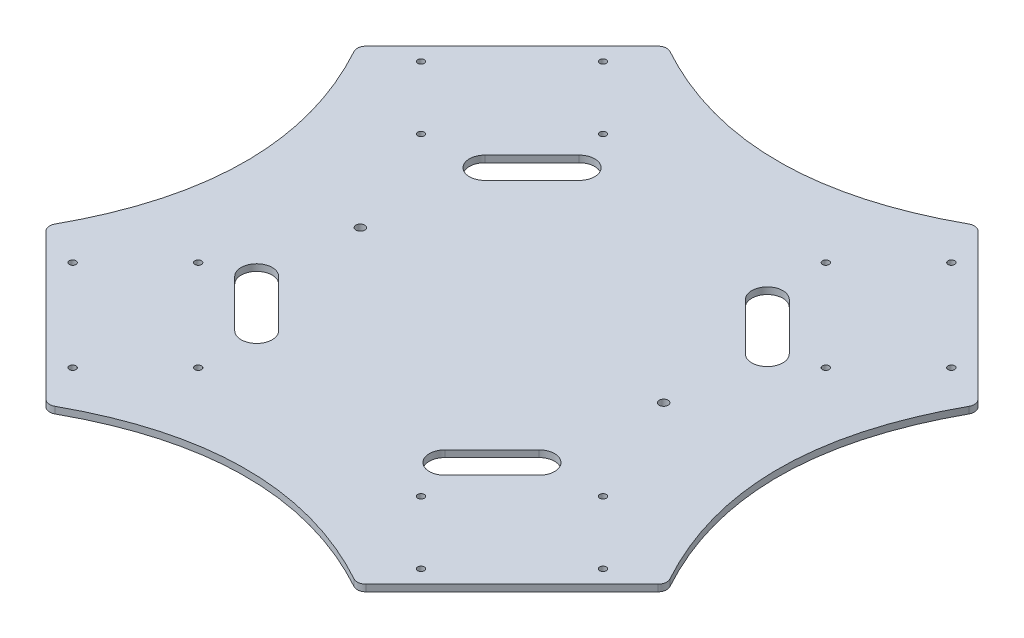
from build123d import *

# Parameters (mm, degrees)
DODANIE_WYCI_GNI_CIE1_DEPTH = 3
ZAOKR_GLENIE1_R             = 4
SZKIC2_R                    = 1.5
WYTNIJ_WYCI_GNI_CIE1_DEPTH  = 197.640104054
SZYK_KO_OWY1_COUNT          = 4
WYTNIJ_WYCI_GNI_CIE2_REACH  = 198.64
SZYK_KO_OWY2_COUNT          = 4
WYTNIJ_WYCI_GNI_CIE3_REACH  = 198.64
SZKIC4_R                    = 2


with BuildPart() as part:
    # Szkic1 → Dodanie-wyciągnięcie1 (new body)
    with BuildSketch(Plane(origin=(0, 0, 0), x_dir=(1, 0, 0), z_dir=(0, 1, 0))):
        with BuildLine():
            Line((-70, -140), (-140, -70))
            add(Edge.make_bspline(
                [(-140, 70), (-100, 0), (-140, -70)],
                knots=[0, 0, 0, 1, 1, 1], degree=2))
            Line((-140, 70), (-70, 140))
            add(Edge.make_bspline(
                [(70, 140), (0, 100), (-70, 140)],
                knots=[0, 0, 0, 1, 1, 1], degree=2))
            Line((70, 140), (140, 70))
            add(Edge.make_bspline(
                [(140, -70), (100, 0), (140, 70)],
                knots=[0, 0, 0, 1, 1, 1], degree=2))
            Line((140, -70), (70, -140))
            add(Edge.make_bspline(
                [(-70, -140), (0, -100), (70, -140)],
                knots=[0, 0, 0, 1, 1, 1], degree=2))
        make_face()
    extrude(amount=DODANIE_WYCI_GNI_CIE1_DEPTH)

    # Zaokrąglenie1
    zaokr_glenie1_edges = [part.edges().sort_by_distance(p)[0] for p in [
        (-140, 1.5, -70),
        (-70, 1.5, -140),
        (70, 1.5, -140),
        (140, 1.5, -70),
        (140, 1.5, 70),
        (70, 1.5, 140),
        (-140, 1.5, 70),
        (-70, 1.5, 140),
    ]]
    fillet(zaokr_glenie1_edges, radius=ZAOKR_GLENIE1_R)

    # Szkic2 → Wytnij-wyciągnięcie1 (cut, through all)
    with BuildSketch(Plane(origin=(0, 3, 0), x_dir=(1, 0, 0), z_dir=(0, 1, 0))):
        with Locations((-78.488852712, -119.501046021)):
            Circle(SZKIC2_R)
        with Locations((-119.501046021, -78.488852712)):
            Circle(SZKIC2_R)
        with Locations((-50.204581464, -91.216774773)):
            Circle(SZKIC2_R)
        with Locations((-91.216774773, -50.204581464)):
            Circle(SZKIC2_R)
    wytnij_wyci_gni_cie1 = extrude(amount=-WYTNIJ_WYCI_GNI_CIE1_DEPTH, mode=Mode.SUBTRACT)

    # Szyk kołowy1: Wytnij-wyciągnięcie1 ×4 about axis
    szyk_ko_owy1_axis = Axis((0, -82.27937755, 0), (0, 1, 0))
    for i in range(1, SZYK_KO_OWY1_COUNT):
        add(wytnij_wyci_gni_cie1.rotate(szyk_ko_owy1_axis, i * 360 / SZYK_KO_OWY1_COUNT), mode=Mode.SUBTRACT)

    # Szkic3 → Wytnij-wyciągnięcie2 (cut, up to next)
    with BuildSketch(Plane(origin=(0, 3, 0), x_dir=(1, 0, 0), z_dir=(0, 1, 0)), mode=Mode.PRIVATE) as wytnij_wyci_gni_cie2_sk1:
        with BuildLine():
            Line((-47.355448856, 77.60029226), (-68.568652292, 56.387088824))
            ThreePointArc((-68.568652292, 56.387088824), (-68.568652292, 46.487593888), (-58.669157355, 46.487593888))
            Line((-58.669157355, 46.487593888), (-37.45595392, 67.700797323))
            ThreePointArc((-37.45595392, 67.700797323), (-37.45595392, 77.60029226), (-47.355448856, 77.60029226))
        make_face()
    wytnij_wyci_gni_cie2_tool1 = extrude(wytnij_wyci_gni_cie2_sk1.sketch, amount=-WYTNIJ_WYCI_GNI_CIE2_REACH, mode=Mode.PRIVATE) & part.part
    wytnij_wyci_gni_cie2 = wytnij_wyci_gni_cie2_tool1.solids().sort_by_distance((-53.012303, 3, -62.043943))[0]
    add(wytnij_wyci_gni_cie2, mode=Mode.SUBTRACT)

    # Szyk kołowy2: Wytnij-wyciągnięcie2 ×4 about axis
    szyk_ko_owy2_axis = Axis((0, -82.27937755, 0), (0, 1, 0))
    for i in range(1, SZYK_KO_OWY2_COUNT):
        add(wytnij_wyci_gni_cie2.rotate(szyk_ko_owy2_axis, i * 360 / SZYK_KO_OWY2_COUNT), mode=Mode.SUBTRACT)

    # Szkic4 → Wytnij-wyciągnięcie3 (cut, up to next)
    with BuildSketch(Plane(origin=(0, 3, 0), x_dir=(1, 0, 0), z_dir=(0, 1, 0)), mode=Mode.PRIVATE) as wytnij_wyci_gni_cie3_sk1:
        with Locations((-68.34, 0)):
            Circle(SZKIC4_R)
    wytnij_wyci_gni_cie3_tool1 = extrude(wytnij_wyci_gni_cie3_sk1.sketch, amount=-WYTNIJ_WYCI_GNI_CIE3_REACH, mode=Mode.PRIVATE) & part.part
    # Szkic4 → Wytnij-wyciągnięcie3 (cut, up to next)
    with BuildSketch(Plane(origin=(0, 3, 0), x_dir=(1, 0, 0), z_dir=(0, 1, 0)), mode=Mode.PRIVATE) as wytnij_wyci_gni_cie3_sk2:
        with Locations((68.34, 0)):
            Circle(SZKIC4_R)
    wytnij_wyci_gni_cie3_tool2 = extrude(wytnij_wyci_gni_cie3_sk2.sketch, amount=-WYTNIJ_WYCI_GNI_CIE3_REACH, mode=Mode.PRIVATE) & part.part
    add(wytnij_wyci_gni_cie3_tool1.solids().sort_by_distance((-68.34, 3, 0))[0], mode=Mode.SUBTRACT)
    add(wytnij_wyci_gni_cie3_tool2.solids().sort_by_distance((68.34, 3, 0))[0], mode=Mode.SUBTRACT)


solid = part.part
